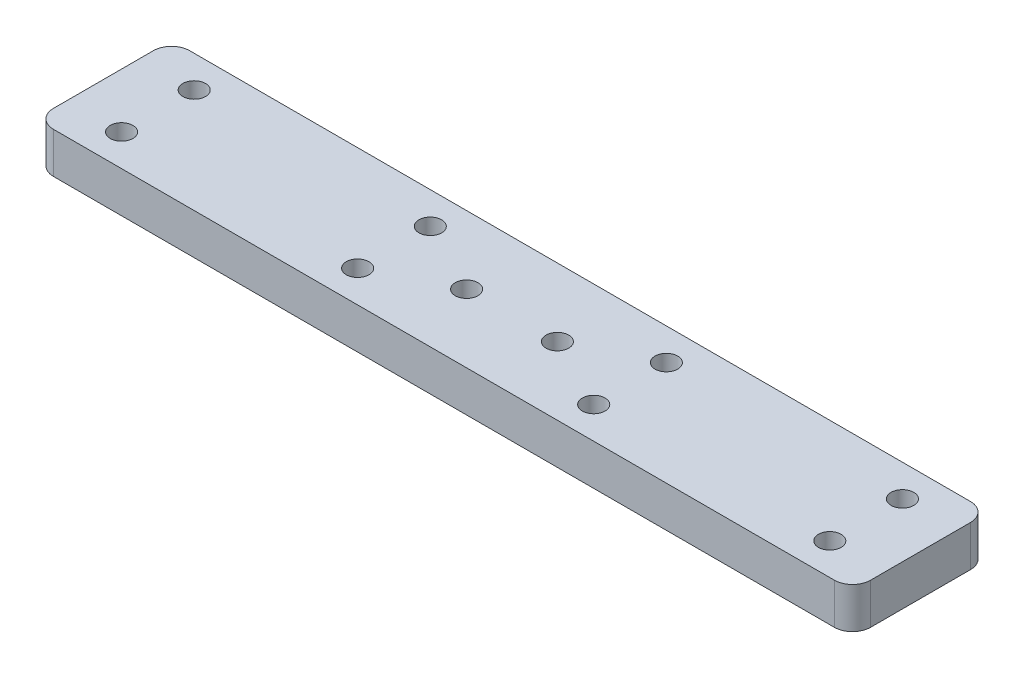
from build123d import *

# Parameters (mm, degrees)
SKETCH_1_R      = 1.25
EXTRUDE_1_DEPTH = 4.5


with BuildPart() as part:
    # 草图1 → 凸台-拉伸1 (new body)
    with BuildSketch(Plane(origin=(0, 0, 0), x_dir=(1, 0, 0), z_dir=(0, 1, 0))):
        with BuildLine():
            Line((-43, 7.5), (43, 7.5))
            ThreePointArc((43, 7.5), (44.414213562, 6.914213562), (45, 5.5))
            Line((45, 5.5), (45, -5.5))
            ThreePointArc((45, -5.5), (44.414213562, -6.914213562), (43, -7.5))
            Line((43, -7.5), (-43, -7.5))
            ThreePointArc((-43, -7.5), (-44.414213562, -6.914213562), (-45, -5.5))
            Line((-45, -5.5), (-45, 5.5))
            ThreePointArc((-45, 5.5), (-44.414213562, 6.914213562), (-43, 7.5))
        make_face()
        with Locations(Location((-5, 0, 0), (0, 0, 270))):
            Circle(SKETCH_1_R, mode=Mode.SUBTRACT)
        with Locations(Location((5, 0, 0), (0, 0, 270))):
            Circle(SKETCH_1_R, mode=Mode.SUBTRACT)
        with Locations(Location((-39, 4, 0), (0, 0, 270))):
            Circle(SKETCH_1_R, mode=Mode.SUBTRACT)
        with Locations(Location((-39, -4, 0), (0, 0, 270))):
            Circle(SKETCH_1_R, mode=Mode.SUBTRACT)
        with Locations(Location((-13, -4, 0), (0, 0, 270))):
            Circle(SKETCH_1_R, mode=Mode.SUBTRACT)
        with Locations(Location((-13, 4, 0), (0, 0, 270))):
            Circle(SKETCH_1_R, mode=Mode.SUBTRACT)
        with Locations(Location((13, -4, 0), (0, 0, 270))):
            Circle(SKETCH_1_R, mode=Mode.SUBTRACT)
        with Locations(Location((13, 4, 0), (0, 0, 270))):
            Circle(SKETCH_1_R, mode=Mode.SUBTRACT)
        with Locations(Location((39, -4, 0), (0, 0, 270))):
            Circle(SKETCH_1_R, mode=Mode.SUBTRACT)
        with Locations(Location((39, 4, 0), (0, 0, 270))):
            Circle(SKETCH_1_R, mode=Mode.SUBTRACT)
    extrude(amount=EXTRUDE_1_DEPTH)


solid = part.part
